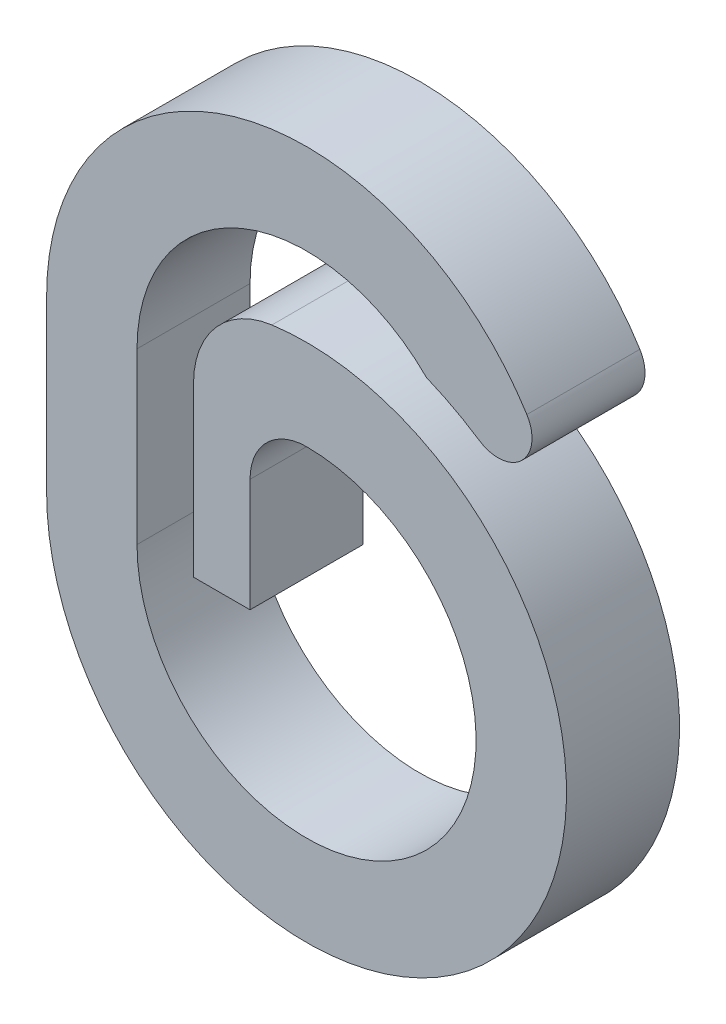
from build123d import *

# Parameters (mm, degrees)
BOSS_EXTRUDE1_DEPTH = 10


with BuildPart() as part:
    # Sketch1 → Boss-Extrude1 (new body)
    with BuildSketch(Plane.XY):
        with BuildLine():
            Line((-23, 0), (-23, 15))
            ThreePointArc((-23, 15), (-6.351498428, 37.105620727), (19.492040672, 27.209027416))
            ThreePointArc((19.492040672, 27.209027416), (19.044286348, 23.468920949), (15.294171401, 23.114635465))
            ThreePointArc((15.294171401, 23.114635465), (13.010187777, 24.473109029), (10.606601718, 25.606601718))
            ThreePointArc((10.606601718, 25.606601718), (-5.740251485, 28.858192988), (-15, 15))
            Line((-15, 15), (-15, 0))
            ThreePointArc((-15, 0), (10.606601718, -10.606601718), (0, 15))
            ThreePointArc((0, 15), (-3.535533906, 13.535533906), (-5, 10))
            Line((-5, 10), (-5, 0))
            Line((-5, 0), (-10, 0))
            Line((-10, 0), (-10, 11.180339887))
            Line((-10, 11.180339887), (-10, 14.866068747))
            ThreePointArc((-10, 14.866068747), (-8.022181222, 20.132313456), (-3.066666667, 22.794638746))
            ThreePointArc((-3.066666667, 22.794638746), (17.313771012, -15.140453538), (-23, 0))
        make_face()
    extrude(amount=BOSS_EXTRUDE1_DEPTH)


solid = part.part
